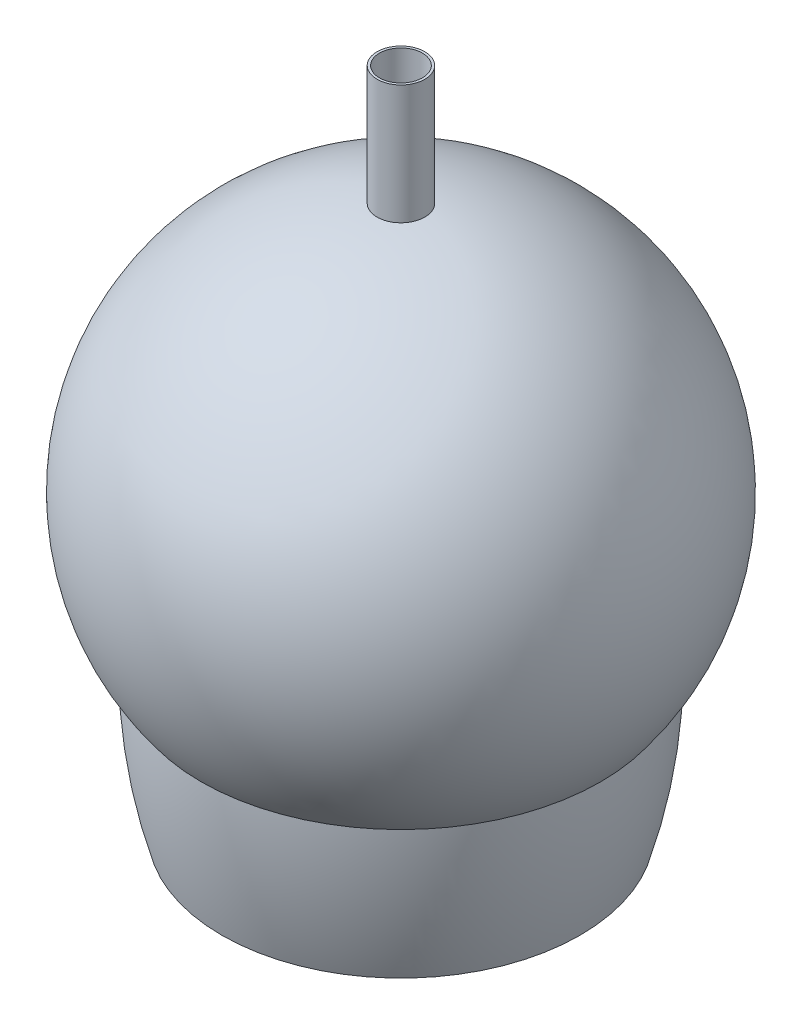
from build123d import *


with BuildPart() as part:
    # Sketch1 → Revolve-Thin1 (revolve)
    with BuildSketch(Plane.XY):
        with BuildLine():
            Line((0, 0), (-75, 0))
            ThreePointArc((-75, 0), (-81.436643777, 29.696137594), (-83.665296811, 60))
            ThreePointArc((-83.665296811, 60), (-96.158654713, 165.616239893), (-10, 227.96654333))
            Line((-10, 227.96654333), (-10, 277.96654333))
            Line((-10, 277.96654333), (-9, 277.96654333))
            Line((-9, 277.96654333), (-9, 227.053663621))
            ThreePointArc((-9, 227.053663621), (-95.127140134, 165.477462314), (-82.666179465, 60.338329285))
            ThreePointArc((-82.666179465, 60.338329285), (-80.523769647, 30.37601117), (-74.248389625, 1))
            Line((-74.248389625, 1), (0, 1))
            Line((0, 1), (0, 0))
        make_face()
    revolve(axis=Axis((0, 0, 0), (0, 1, 0)))


solid = part.part
